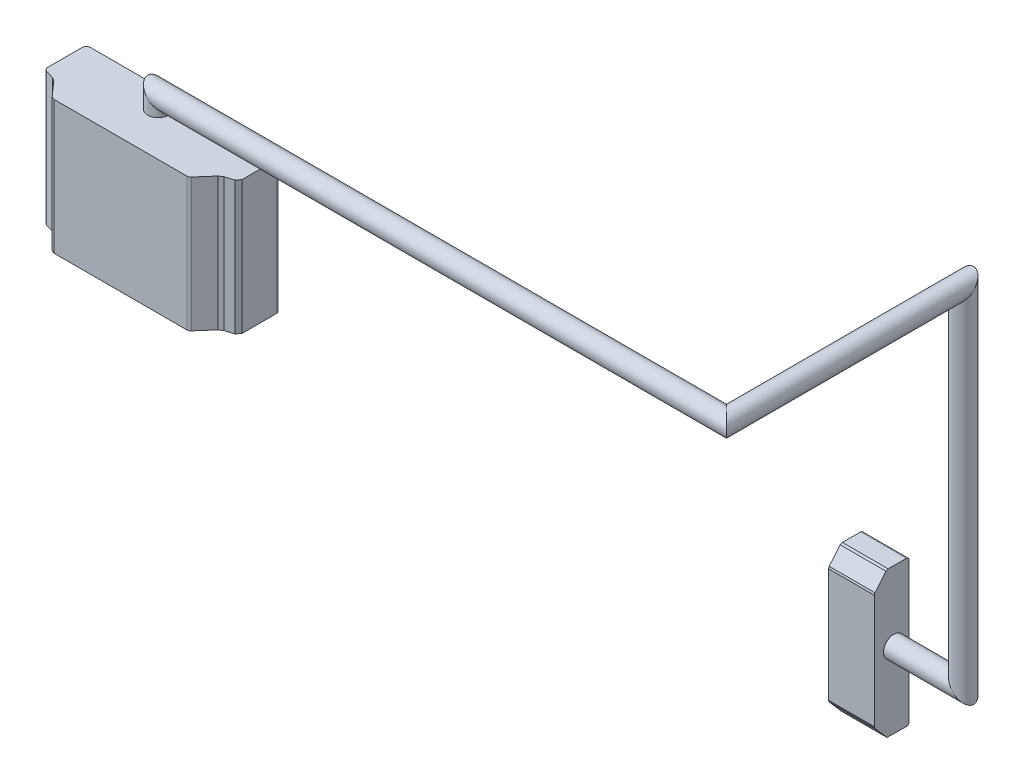
from build123d import *

# Parameters (mm, degrees)
ESQUISSE3_R        = 0.75
BOSS_EXTRU_1_DEPTH = 9.6
BOSS_EXTRU_2_DEPTH = 3.3


with BuildPart() as part:
    # Balayage4: sweep along a curve in space
    with BuildLine() as balayage4_path:
        Line((0, 0, 0), (5, 0, 0))
        Line((5, 0, 0), (5, 25.07, 0))
        Line((5, 25.07, 0), (5, 25.07, 17.06))
        Line((5, 25.07, 17.06), (-35.94, 25.07, 17.06))
        Line((-35.94, 25.07, 17.06), (-35.94, 24.07, 17.06))
    # Esquisse3 → Balayage4 (sweep)
    with BuildSketch(Plane(origin=(0, 0, 0), x_dir=(0, 0, -1), z_dir=(1, 0, 0))):
        Circle(ESQUISSE3_R)
    sweep(path=balayage4_path.line, transition=Transition.RIGHT)

    # Esquisse4 → Boss.-Extru.1 (add)
    with BuildSketch(Plane.XZ.offset(-24.07)):
        with BuildLine():
            Line((-28.529069989, 15.951817831), (-28.529069989, 18.430245431))
            Line((-28.529069989, 18.430245431), (-28.740844235, 18.716979133))
            Line((-28.740844235, 18.716979133), (-29.3555682, 18.906124969))
            Line((-29.3555682, 18.906124969), (-29.606713417, 19.068458081))
            Line((-29.606713417, 19.068458081), (-30.514475757, 20.100006195))
            ThreePointArc((-30.514475757, 20.100006195), (-30.616110911, 20.175182519), (-30.739689812, 20.201817826))
            Line((-30.739689812, 20.201817826), (-40.318450167, 20.201817826))
            Line((-40.318450167, 20.201817826), (-40.543664222, 20.100006195))
            Line((-40.543664222, 20.100006195), (-41.451426562, 19.068458081))
            Line((-41.451426562, 19.068458081), (-41.702571779, 18.906124969))
            Line((-41.702571779, 18.906124969), (-42.317295744, 18.716979133))
            ThreePointArc((-42.317295744, 18.716979133), (-42.470386925, 18.608476003), (-42.529069989, 18.430245431))
            Line((-42.529069989, 18.430245431), (-42.529069989, 15.951817831))
            ThreePointArc((-42.529069989, 15.951817831), (-42.441202024, 15.739685796), (-42.229069989, 15.651817831))
            Line((-42.229069989, 15.651817831), (-28.829069989, 15.651817831))
            ThreePointArc((-28.829069989, 15.651817831), (-28.616937955, 15.739685796), (-28.529069989, 15.951817831))
        make_face()
    extrude(amount=BOSS_EXTRU_1_DEPTH)

    # Esquisse5 → Boss.-Extru.2 (add)
    with BuildSketch(Plane.ZY):
        with BuildLine():
            Line((-1.092354738, 4.837960255), (-1.092354738, -5.262039745))
            ThreePointArc((-1.092354738, -5.262039745), (-1.033776094, -5.403461102), (-0.892354738, -5.462039745))
            Line((-0.892354738, -5.462039745), (0.498872789, -5.443254351))
            Line((0.498872789, -5.443254351), (1.360996797, -4.442758746))
            Line((1.360996797, -4.442758746), (1.407645262, -4.314371414))
            Line((1.407645262, -4.314371414), (1.407645262, 3.890291924))
            Line((1.407645262, 3.890291924), (1.360996797, 4.018679255))
            Line((1.360996797, 4.018679255), (0.567600055, 4.966347586))
            Line((0.567600055, 4.966347586), (0.41424852, 5.037960255))
            Line((0.41424852, 5.037960255), (-0.892354738, 5.037960255))
            ThreePointArc((-0.892354738, 5.037960255), (-1.033776094, 4.979381611), (-1.092354738, 4.837960255))
        make_face()
    extrude(amount=BOSS_EXTRU_2_DEPTH)


solid = part.part
